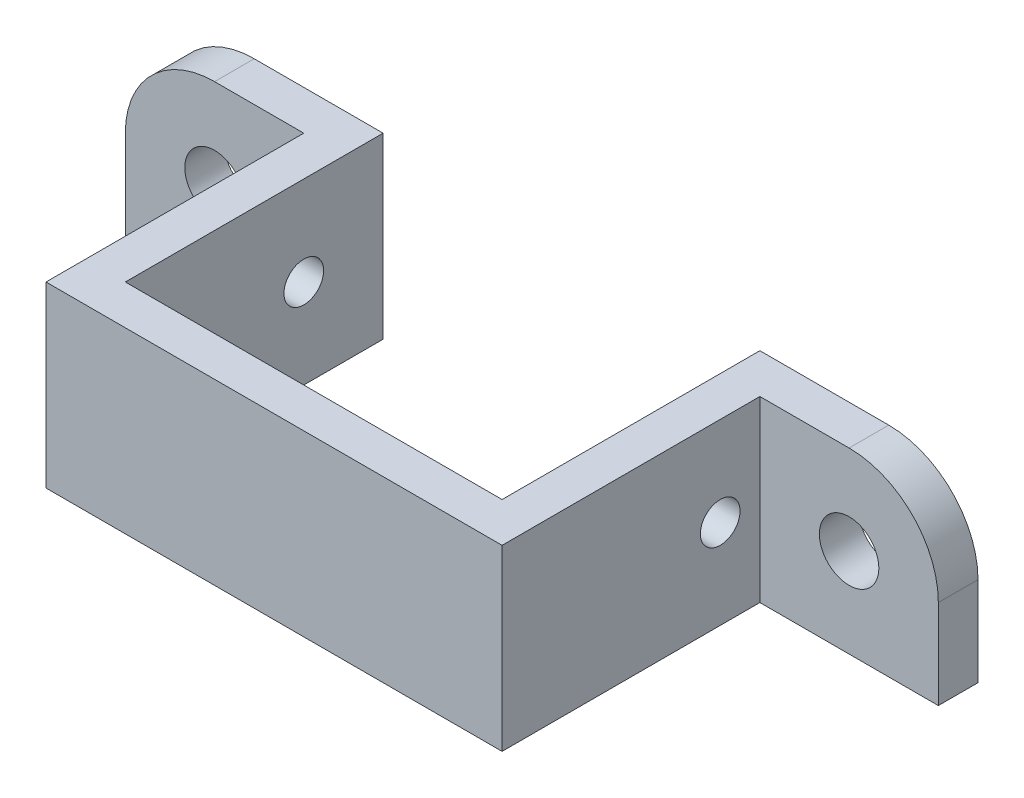
from build123d import *

# Parameters (mm, degrees)
BOSS_EXTRUDE1_DEPTH = 9
SKETCH2_R           = 1
CUT_EXTRUDE1_DEPTH  = 36.693136595
SKETCH3_R           = 1.5
CUT_EXTRUDE2_DEPTH  = 26.889186932


with BuildPart() as part:
    # Sketch1 → Boss-Extrude1 (new body)
    with BuildSketch(Plane(origin=(0, 0, 0), x_dir=(1, 0, 0), z_dir=(0, 1, 0))):
        Polygon((-20.5, 13), (-9.5, 13), (-9.5, 0), (9.5, 0), (9.5, 13), (20.5, 13), (20.5, 11), (11.5, 11), (11.5, -2), (-11.5, -2), (-11.5, 11), (-20.5, 11), align=None)
    extrude(amount=BOSS_EXTRUDE1_DEPTH)

    # Sketch2 → Cut-Extrude1 (cut, through all)
    with BuildSketch(Plane.ZY.offset(11.5)):
        with Locations((-9, 4.5)):
            Circle(SKETCH2_R)
    extrude(amount=-CUT_EXTRUDE1_DEPTH, mode=Mode.SUBTRACT)

    # Sketch3 → Cut-Extrude2 (cut, through all)
    with BuildSketch(Plane.XY.offset(-11)):
        with Locations((-16, 4.5)):
            Circle(SKETCH3_R)
        with BuildLine():
            Line((-20.5, 9), (-20.5, 4.5))
            ThreePointArc((-20.5, 4.5), (-19.181980515, 7.681980515), (-16, 9))
            Line((-16, 9), (-20.5, 9))
        make_face()
        with BuildLine():
            Line((20.5, 4.5), (20.5, 9))
            Line((20.5, 9), (16, 9))
            ThreePointArc((16, 9), (19.181980515, 7.681980515), (20.5, 4.5))
        make_face()
        with Locations((16, 4.5)):
            Circle(SKETCH3_R)
    extrude(amount=-CUT_EXTRUDE2_DEPTH, mode=Mode.SUBTRACT)


solid = part.part
